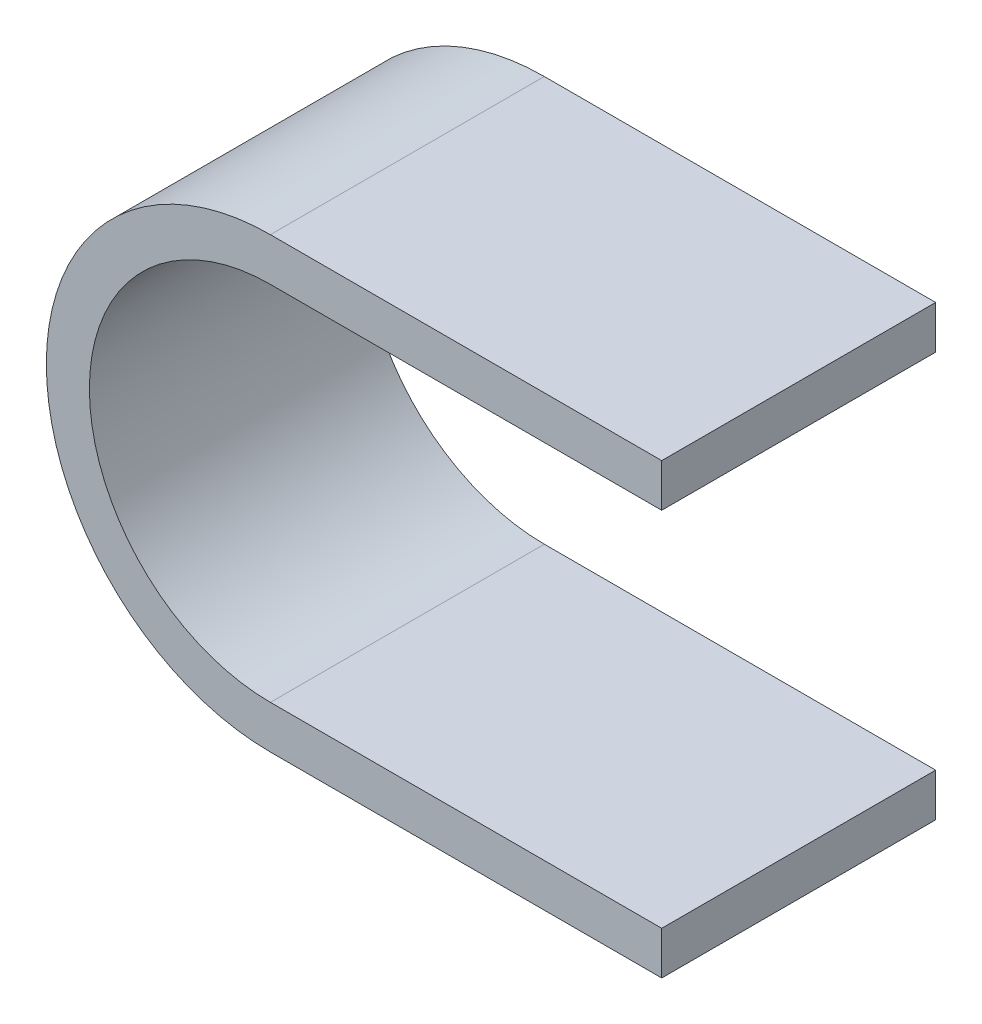
from build123d import *

# Parameters (mm, degrees)
BOSS_EXTRUDE1_DEPTH = 28


with BuildPart() as part:
    # Sketch1 → Boss-Extrude1 (new body)
    with BuildSketch(Plane.XY):
        with BuildLine():
            ThreePointArc((0, 22.9), (7.09788701, 21.772230019), (13.496666255, 18.5))
            Line((13.496666255, 18.5), (40, 18.5))
            Line((40, 18.5), (40, 22.9))
            Line((40, 22.9), (0, 22.9))
        make_face()
        with BuildLine():
            ThreePointArc((0, -18.5), (-18.5, 0), (0, 18.5))
            Line((0, 18.5), (13.496666255, 18.5))
            ThreePointArc((13.496666255, 18.5), (7.09788701, 21.772230019), (0, 22.9))
            ThreePointArc((0, 22.9), (-22.9, 0), (0, -22.9))
            ThreePointArc((0, -22.9), (7.09788701, -21.772230019), (13.496666255, -18.5))
            Line((13.496666255, -18.5), (0, -18.5))
        make_face()
        with BuildLine():
            Line((40, -18.5), (13.496666255, -18.5))
            ThreePointArc((13.496666255, -18.5), (7.09788701, -21.772230019), (0, -22.9))
            Line((0, -22.9), (40, -22.9))
            Line((40, -22.9), (40, -18.5))
        make_face()
    extrude(amount=BOSS_EXTRUDE1_DEPTH)


solid = part.part
